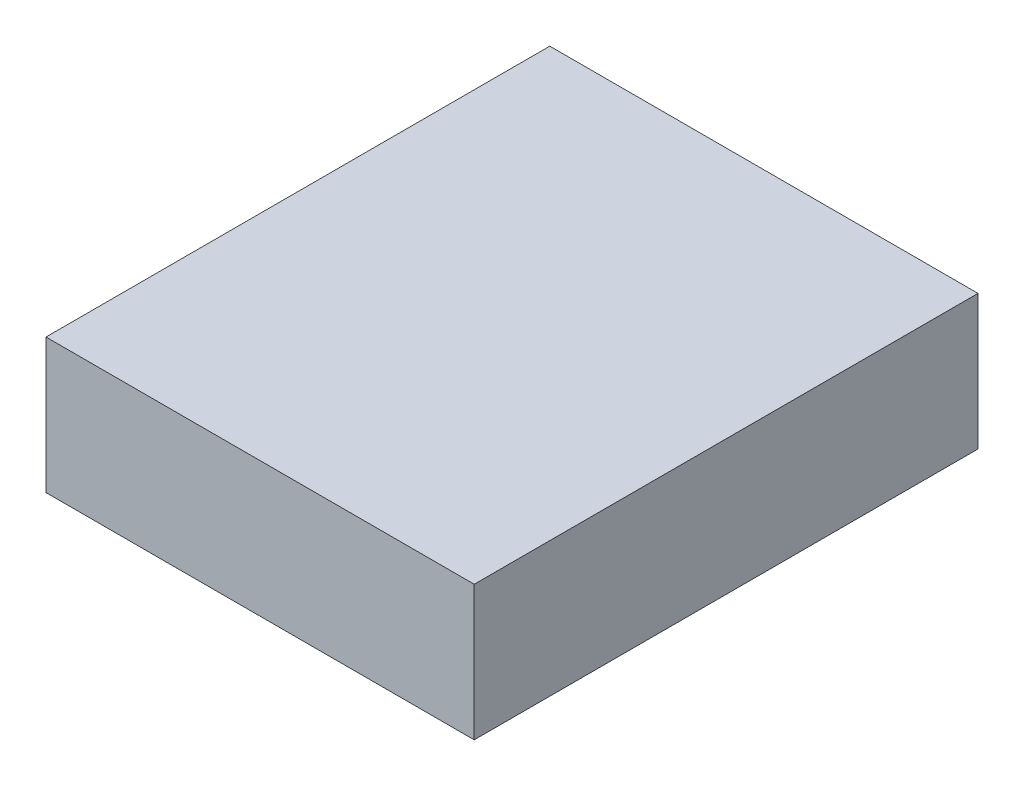
from build123d import *

# Parameters (mm, degrees)
SKETCH1_W           = 34
SKETCH1_H           = 40
BOSS_EXTRUDE1_DEPTH = 10.7


with BuildPart() as part:
    # Sketch1 → Boss-Extrude1 (new body)
    with BuildSketch(Plane(origin=(0, 0, 0), x_dir=(1, 0, 0), z_dir=(0, 1, 0))):
        Rectangle(SKETCH1_W, SKETCH1_H)
    extrude(amount=BOSS_EXTRUDE1_DEPTH)


solid = part.part
